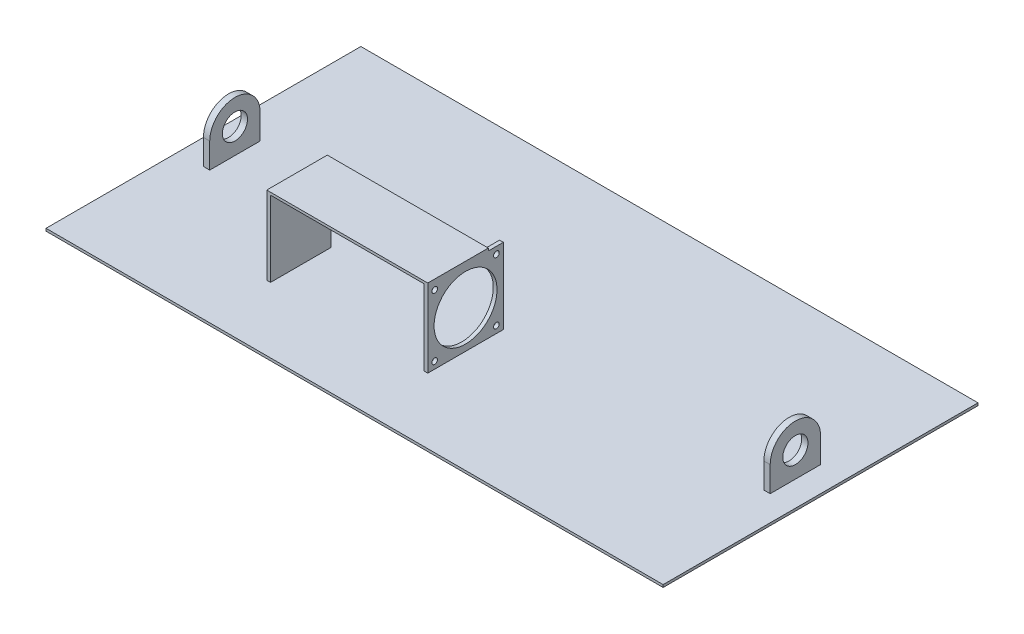
from build123d import *

# Parameters (mm, degrees)
SKETCH_1_W          = 490
SKETCH_1_H          = 250
EXTRUDE_1_DEPTH     = 2
SKETCH_2_W          = 5
SKETCH_2_H          = 40
EXTRUDE_2_DEPTH     = 40
CUT_EXTRUDE_1_DEPTH = 40
SKETCH_4_R          = 10
CUT_EXTRUDE_2_DEPTH = 40
SKETCH_5_W          = 3
SKETCH_5_H          = 60
EXTRUDE_3_DEPTH     = 60
CUT_EXTRUDE_3_REACH = 359.69
SKETCH_6_R          = 25
CUT_EXTRUDE_4_REACH = 359.69
SKETCH_7_R          = 2.25
SKETCH_9_W          = 3
SKETCH_9_H          = 48.07
EXTRUDE_4_DEPTH     = 60
SKETCH_10_W         = 127.84
SKETCH_10_H         = 48.07
EXTRUDE_5_DEPTH     = 2


with BuildPart() as part:
    # 草图1 → 凸台-拉伸1 (new body)
    with BuildSketch(Plane(origin=(0, 0, 0), x_dir=(1, 0, 0), z_dir=(0, 1, 0))):
        with Locations((245, 125)):
            Rectangle(SKETCH_1_W, SKETCH_1_H)
    extrude(amount=EXTRUDE_1_DEPTH)

    # 草图2 → 凸台-拉伸2 (add)
    with BuildSketch(Plane(origin=(0, 2, 0), x_dir=(1, 0, 0), z_dir=(0, 1, 0))):
        with Locations((467.5, 125)):
            Rectangle(SKETCH_2_W, SKETCH_2_H)
    extrude_2 = extrude(amount=EXTRUDE_2_DEPTH)

    # 草图3 → 切除-拉伸1 (cut)
    with BuildSketch(Plane(origin=(470, 0, 0), x_dir=(0, 0, -1), z_dir=(1, 0, 0))):
        with BuildLine():
            ThreePointArc((105, 22), (110.857864376, 36.142135624), (125, 42))
            Line((125, 42), (105, 42))
            Line((105, 42), (105, 22))
        make_face()
        with BuildLine():
            Line((145, 42), (125, 42))
            ThreePointArc((125, 42), (139.142135624, 36.142135624), (145, 22))
            Line((145, 22), (145, 42))
        make_face()
    cut_extrude_1 = extrude(amount=-CUT_EXTRUDE_1_DEPTH, mode=Mode.SUBTRACT)

    # 草图4 → 切除-拉伸2 (cut)
    with BuildSketch(Plane(origin=(470, 0, 0), x_dir=(0, 0, -1), z_dir=(1, 0, 0))):
        with Locations((125, 22)):
            Circle(SKETCH_4_R)
    cut_extrude_2 = extrude(amount=-CUT_EXTRUDE_2_DEPTH, mode=Mode.SUBTRACT)

    # 镜向1: 凸台-拉伸2, 切除-拉伸1, 切除-拉伸2 across plane
    add(extrude_2.mirror(Plane(origin=(245, 0, 0), x_dir=(0, 0, 1), z_dir=(1, 0, 0))))
    add(cut_extrude_1.mirror(Plane(origin=(245, 0, 0), x_dir=(0, 0, 1), z_dir=(1, 0, 0))), mode=Mode.SUBTRACT)
    add(cut_extrude_2.mirror(Plane(origin=(245, 0, 0), x_dir=(0, 0, 1), z_dir=(1, 0, 0))), mode=Mode.SUBTRACT)

    # 草图5 → 凸台-拉伸3 (add)
    with BuildSketch(Plane(origin=(0, 2, 0), x_dir=(1, 0, 0), z_dir=(0, 1, 0))):
        with Locations((249.69, 81.93)):
            Rectangle(SKETCH_5_W, SKETCH_5_H)
    extrude(amount=EXTRUDE_3_DEPTH)

    # 草图6 → 切除-拉伸3 (cut, up to next)
    with BuildSketch(Plane.ZY.offset(-248.19), mode=Mode.PRIVATE) as cut_extrude_3_sk1:
        with Locations((-81.93, 32)):
            Circle(SKETCH_6_R)
    cut_extrude_3_tool1 = extrude(cut_extrude_3_sk1.sketch, amount=-CUT_EXTRUDE_3_REACH, mode=Mode.PRIVATE) & part.part
    add(cut_extrude_3_tool1.solids().sort_by_distance((248.19, 32, -81.93))[0], mode=Mode.SUBTRACT)

    # 草图7 → 切除-拉伸4 (cut, up to next)
    with BuildSketch(Plane.ZY.offset(-248.19), mode=Mode.PRIVATE) as cut_extrude_4_sk1:
        with Locations((-57.43, 56.5)):
            Circle(SKETCH_7_R)
    cut_extrude_4_tool1 = extrude(cut_extrude_4_sk1.sketch, amount=-CUT_EXTRUDE_4_REACH, mode=Mode.PRIVATE) & part.part
    # 草图7 → 切除-拉伸4 (cut, up to next)
    with BuildSketch(Plane.ZY.offset(-248.19), mode=Mode.PRIVATE) as cut_extrude_4_sk2:
        with Locations((-57.43, 7.5)):
            Circle(SKETCH_7_R)
    cut_extrude_4_tool2 = extrude(cut_extrude_4_sk2.sketch, amount=-CUT_EXTRUDE_4_REACH, mode=Mode.PRIVATE) & part.part
    # 草图7 → 切除-拉伸4 (cut, up to next)
    with BuildSketch(Plane.ZY.offset(-248.19), mode=Mode.PRIVATE) as cut_extrude_4_sk3:
        with Locations((-106.43, 7.5)):
            Circle(SKETCH_7_R)
    cut_extrude_4_tool3 = extrude(cut_extrude_4_sk3.sketch, amount=-CUT_EXTRUDE_4_REACH, mode=Mode.PRIVATE) & part.part
    # 草图7 → 切除-拉伸4 (cut, up to next)
    with BuildSketch(Plane.ZY.offset(-248.19), mode=Mode.PRIVATE) as cut_extrude_4_sk4:
        with Locations((-106.43, 56.5)):
            Circle(SKETCH_7_R)
    cut_extrude_4_tool4 = extrude(cut_extrude_4_sk4.sketch, amount=-CUT_EXTRUDE_4_REACH, mode=Mode.PRIVATE) & part.part
    add(cut_extrude_4_tool1.solids().sort_by_distance((248.19, 56.5, -57.43))[0], mode=Mode.SUBTRACT)
    add(cut_extrude_4_tool2.solids().sort_by_distance((248.19, 7.5, -57.43))[0], mode=Mode.SUBTRACT)
    add(cut_extrude_4_tool3.solids().sort_by_distance((248.19, 7.5, -106.43))[0], mode=Mode.SUBTRACT)
    add(cut_extrude_4_tool4.solids().sort_by_distance((248.19, 56.5, -106.43))[0], mode=Mode.SUBTRACT)

    # 草图9 → 凸台-拉伸4 (add)
    with BuildSketch(Plane(origin=(0, 2, 0), x_dir=(1, 0, 0), z_dir=(0, 1, 0))):
        with Locations((124.85, 75.965)):
            Rectangle(SKETCH_9_W, SKETCH_9_H)
    extrude(amount=EXTRUDE_4_DEPTH)

    # 草图10 → 凸台-拉伸5 (add)
    with BuildSketch(Plane(origin=(0, 62, 0), x_dir=(1, 0, 0), z_dir=(0, 1, 0))):
        with Locations((187.27, 75.965)):
            Rectangle(SKETCH_10_W, SKETCH_10_H)
    extrude(amount=EXTRUDE_5_DEPTH)


solid = part.part
